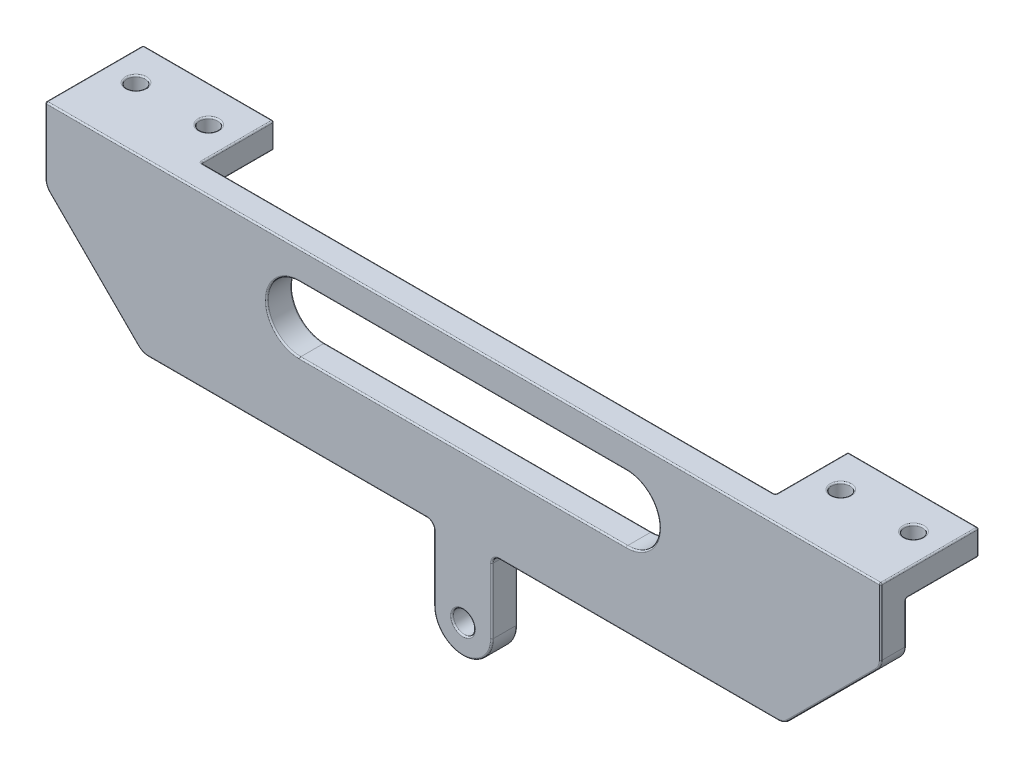
from build123d import *

# Parameters (mm, degrees)
SKETCH5_R           = 1.5
BOSS_EXTRUDE1_DEPTH = 3.5
SKETCH6_W           = 18
SKETCH6_H           = 10
SKETCH6_R           = 1.25
BOSS_EXTRUDE2_DEPTH = 3.5
FILLET1_R           = 2
FILLET2_R           = 1
FILLET3_R           = 0.2


with BuildPart() as part:
    # Sketch5 → Boss-Extrude1 (new body)
    with BuildSketch(Plane.XY):
        with BuildLine():
            Line((4, 60), (4, 70))
            Line((4, 70), (44.142135624, 70))
            Line((44.142135624, 70), (57.5, 83.35))
            Line((57.5, 83.35), (57.5, 93.35))
            Line((57.5, 93.35), (-57.5, 93.35))
            Line((-57.5, 93.35), (-57.5, 83.35))
            Line((-57.5, 83.35), (-44.142135624, 70))
            Line((-44.142135624, 70), (-4, 70))
            Line((-4, 70), (-4, 60))
            ThreePointArc((-4, 60), (0, 56), (4, 60))
        make_face()
        with Locations((0, 60)):
            Circle(SKETCH5_R, mode=Mode.SUBTRACT)
        with BuildLine():
            Line((22.5, 89.35), (-22.5, 89.35))
            ThreePointArc((-22.5, 89.35), (-27, 84.85), (-22.5, 80.35))
            Line((-22.5, 80.35), (22.5, 80.35))
            ThreePointArc((22.5, 80.35), (27, 84.85), (22.5, 89.35))
        make_face(mode=Mode.SUBTRACT)
    extrude(amount=BOSS_EXTRUDE1_DEPTH)

    # Sketch6 → Boss-Extrude2 (add)
    # profile 1 of 2: a face of its own
    with BuildSketch(Plane(origin=(0, 93.35, 0), x_dir=(1, 0, 0), z_dir=(0, 1, 0))):
        with Locations((-48.5, 5)):
            Rectangle(SKETCH6_W, SKETCH6_H)
        with Locations(Location((-53.5, 5, 0), (0, 0, 270))):
            Circle(SKETCH6_R, mode=Mode.SUBTRACT)
        with Locations(Location((-43.5, 5, 0), (0, 0, 270))):
            Circle(SKETCH6_R, mode=Mode.SUBTRACT)
    # profile 2 of 2: a face of its own
    with BuildSketch(Plane(origin=(0, 93.35, 0), x_dir=(1, 0, 0), z_dir=(0, 1, 0))):
        with Locations((48.5, 5)):
            Rectangle(SKETCH6_W, SKETCH6_H)
        with Locations(Location((43.5, 5, 0), (0, 0, 90))):
            Circle(SKETCH6_R, mode=Mode.SUBTRACT)
        with Locations(Location((53.5, 5, 0), (0, 0, 90))):
            Circle(SKETCH6_R, mode=Mode.SUBTRACT)
    extrude(amount=-BOSS_EXTRUDE2_DEPTH)

    # Fillet1
    fillet1_edges = [part.edges().sort_by_distance(p)[0] for p in [
        (-44.142135624, 70, 1.75),
        (-57.5, 83.35, 1.75),
        (57.5, 83.35, 1.75),
        (44.142135624, 70, 1.75),
    ]]
    fillet(fillet1_edges, radius=FILLET1_R)

    # Fillet2
    fillet2_edges = [part.edges().sort_by_distance(p)[0] for p in [
        (-4, 70, 1.75),
        (4, 70, 1.75),
    ]]
    fillet(fillet2_edges, radius=FILLET2_R)

    # Fillet3
    fillet3_edges = [part.edges().sort_by_distance(p)[0] for p in [
        (-4, 64.5, 0),
        (-4, 64.5, 3.5),
        (24.157026729, 70, 0),
        (24.157026729, 70, 3.5),
        (-4.292893219, 69.707106781, 0),
        (-4.292893219, 69.707106781, 3.5),
        (4.292893219, 69.707106781, 0),
        (4.292893219, 69.707106781, 3.5),
        (4, 64.5, 0),
        (0, 56, 0),
        (-57.5, 93.35, -3.25),
        (57.5, 93.35, -3.25),
        (0, 93.35, 3.5),
        (-57.5, 88.764386063, 3.5),
        (-27, 84.85, 0),
        (0, 80.35, 0),
        (27, 84.85, 0),
        (0, 89.35, 0),
        (-27, 84.85, 3.5),
        (0, 80.35, 3.5),
        (27, 84.85, 3.5),
        (0, 89.35, 3.5),
        (-1.5, 60, 0),
        (-1.5, 60, 3.5),
        (-57.5, 87.014386063, 0),
        (0, 56, 3.5),
        (-57.5, 89.85, -5),
        (-48.5, 89.85, -10),
        (-57.5, 91.6, -10),
        (-39.5, 89.85, -5),
        (-39.5, 91.6, -10),
        (-48.5, 89.85, 0),
        (-39.5, 91.6, 0),
        (-43.5, 89.85, -6.25),
        (-53.5, 89.85, -6.25),
        (-39.5, 93.35, -5),
        (-48.5, 93.35, -10),
        (-53.5, 93.35, -6.25),
        (-43.5, 93.35, -6.25),
        (0, 93.35, 0),
        (48.5, 89.85, -10),
        (39.5, 91.6, -10),
        (57.5, 89.85, -5),
        (57.5, 91.6, -10),
        (48.5, 89.85, 0),
        (39.5, 91.6, 0),
        (53.5, 89.85, -3.75),
        (43.5, 89.85, -3.75),
        (48.5, 93.35, -10),
        (39.5, 93.35, -5),
        (43.5, 93.35, -3.75),
        (53.5, 93.35, -3.75),
        (50.820823802, 76.674756134, 0),
        (50.820823802, 76.674756134, 3.5),
        (57.5, 87.014386063, 0),
        (-24.157026729, 70, 0),
        (-50.820823802, 76.674756134, 0),
        (-57.34764636, 83.413133225, 0),
        (-44.07914827, 70.15212827, 0),
        (57.34764636, 83.413133225, 0),
        (44.07914827, 70.15212827, 0),
        (4, 64.5, 3.5),
        (57.5, 88.764386063, 3.5),
        (-50.820823802, 76.674756134, 3.5),
        (-24.157026729, 70, 3.5),
        (-57.34764636, 83.413133225, 3.5),
        (-44.07914827, 70.15212827, 3.5),
        (57.34764636, 83.413133225, 3.5),
        (44.07914827, 70.15212827, 3.5),
    ]]
    fillet(fillet3_edges, radius=FILLET3_R)


solid = part.part
